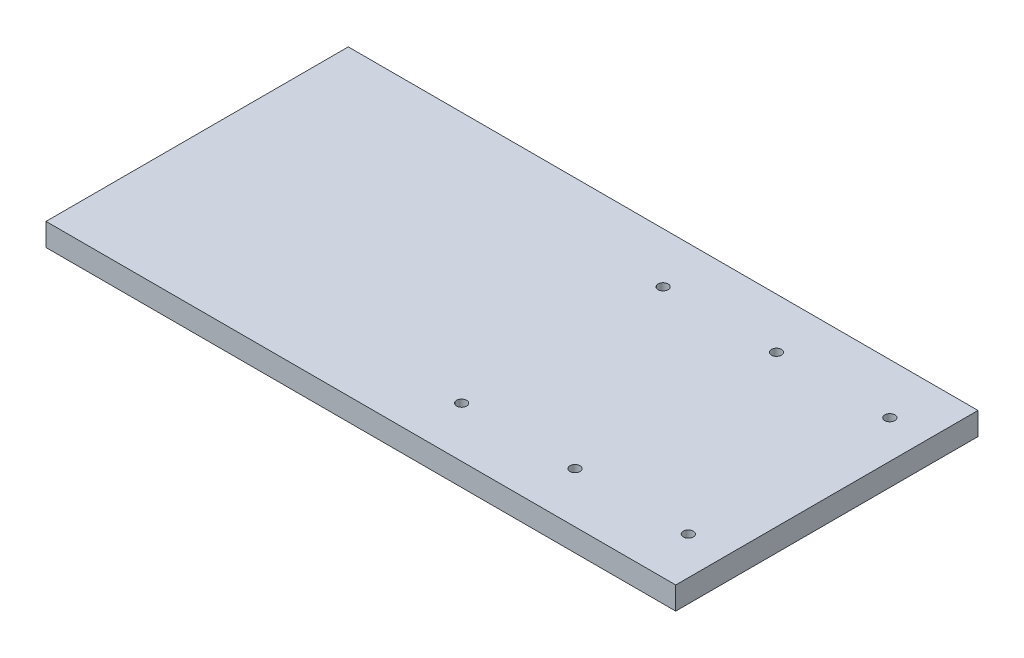
from build123d import *

# Parameters (mm, degrees)
SKETCH_1_W      = 500
SKETCH_1_H      = 240
SKETCH_1_R      = 4
EXTRUDE_1_DEPTH = 18


with BuildPart() as part:
    # Эскиз1 → Бобышка-Вытянуть1 (new body)
    with BuildSketch(Plane(origin=(0, 0, 0), x_dir=(1, 0, 0), z_dir=(0, 1, 0))):
        with Locations((250, 120)):
            Rectangle(SKETCH_1_W, SKETCH_1_H)
        with Locations(Location((470, 200, 0), (0, 0, 270))):
            Circle(SKETCH_1_R, mode=Mode.SUBTRACT)
        with Locations(Location((380, 200, 0), (0, 0, 270))):
            Circle(SKETCH_1_R, mode=Mode.SUBTRACT)
        with Locations(Location((290, 200, 0), (0, 0, 270))):
            Circle(SKETCH_1_R, mode=Mode.SUBTRACT)
        with Locations(Location((470, 40, 0), (0, 0, 270))):
            Circle(SKETCH_1_R, mode=Mode.SUBTRACT)
        with Locations(Location((380, 40, 0), (0, 0, 270))):
            Circle(SKETCH_1_R, mode=Mode.SUBTRACT)
        with Locations(Location((290, 40, 0), (0, 0, 270))):
            Circle(SKETCH_1_R, mode=Mode.SUBTRACT)
    extrude(amount=EXTRUDE_1_DEPTH)


solid = part.part
